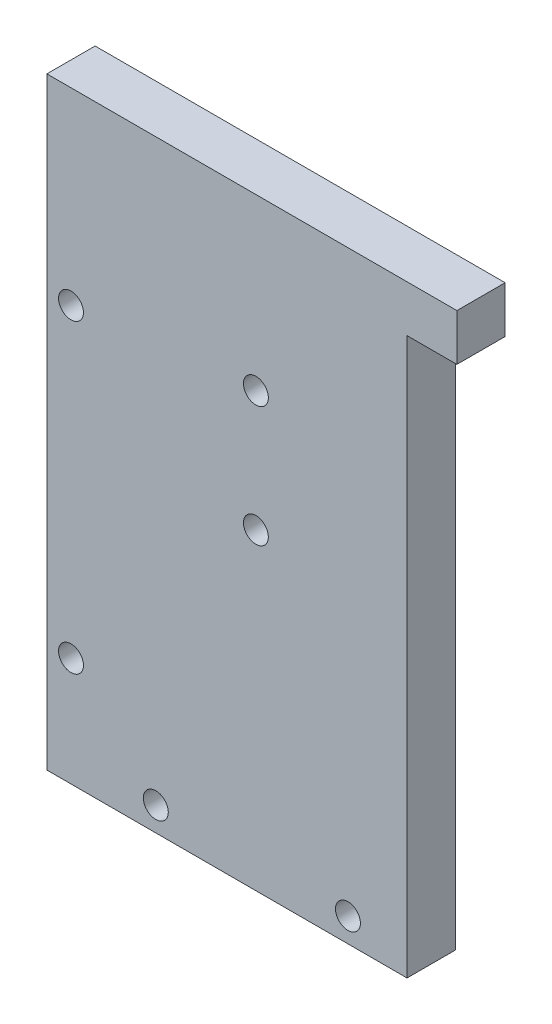
from build123d import *

# Parameters (mm, degrees)
SZKIC1_W                    = 51
SZKIC1_H                    = 75
DODANIE_WYCI_GNI_CIE1_DEPTH = 6
SZKIC3_R                    = 1.55
WYTNIJ_WYCI_GNI_CIE1_DEPTH  = 99.368039697
SZKIC5_R                    = 1.55
WYTNIJ_WYCI_GNI_CIE2_DEPTH  = 6
SZKIC6_W                    = 6.4
SZKIC6_H                    = 69.4
WYTNIJ_WYCI_GNI_CIE3_DEPTH  = 10


with BuildPart() as part:
    # Szkic1 → Dodanie-wyciągnięcie1 (new body)
    with BuildSketch(Plane.XY):
        with Locations((29.991181586, 43.5)):
            Rectangle(SZKIC1_W, SZKIC1_H)
    extrude(amount=DODANIE_WYCI_GNI_CIE1_DEPTH)

    # Szkic3 → Wytnij-wyciągnięcie1 (cut, through all)
    with BuildSketch(Plane(origin=(0, 0, 0), x_dir=(-1, 0, 0), z_dir=(0, 0, -1))):
        with Locations((-18.041181586, 9)):
            Circle(SZKIC3_R)
        with Locations((-41.941181586, 9)):
            Circle(SZKIC3_R)
        with Locations((-7.491181586, 19.55)):
            Circle(SZKIC3_R)
        with Locations((-7.491181586, 57.55)):
            Circle(SZKIC3_R)
    extrude(amount=-WYTNIJ_WYCI_GNI_CIE1_DEPTH, mode=Mode.SUBTRACT)

    # Szkic5 → Wytnij-wyciągnięcie2 (cut)
    with BuildSketch(Plane(origin=(0, 0, 0), x_dir=(-1, 0, 0), z_dir=(0, 0, -1))):
        with Locations((-30.491181586, 59.871958533)):
            Circle(SZKIC5_R)
        with Locations((-30.491181586, 44.871958533)):
            Circle(SZKIC5_R)
    extrude(amount=-WYTNIJ_WYCI_GNI_CIE2_DEPTH, mode=Mode.SUBTRACT)

    # Szkic6 → Wytnij-wyciągnięcie3 (cut)
    with BuildSketch(Plane(origin=(0, 0, 0), x_dir=(-1, 0, 0), z_dir=(0, 0, -1))):
        with Locations((-52.491181586, 40.5)):
            Rectangle(SZKIC6_W, SZKIC6_H)
    extrude(amount=-WYTNIJ_WYCI_GNI_CIE3_DEPTH, mode=Mode.SUBTRACT)


solid = part.part
